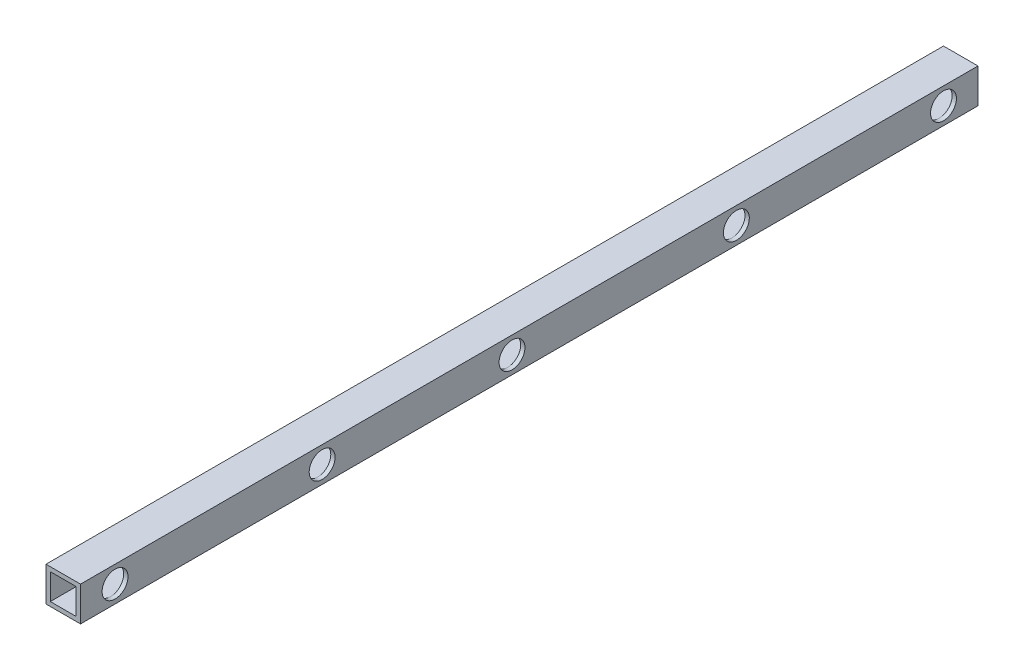
from build123d import *

# Parameters (mm, degrees)
SKETCH1_W           = 25.4
SKETCH1_H           = 25.4
SKETCH1_W_2         = 19.05
SKETCH1_H_2         = 19.05
EXTRUDE_THIN1_DEPTH = 660.4
SKETCH2_R           = 9.525
CUT_EXTRUDE1_DEPTH  = 662.376201568


with BuildPart() as part:
    # Sketch1 → Extrude-Thin1 (new body)
    with BuildSketch(Plane.XY):
        with Locations((-12.7, 12.7)):
            Rectangle(SKETCH1_W, SKETCH1_H)
        with Locations((-12.7, 12.7)):
            Rectangle(SKETCH1_W_2, SKETCH1_H_2, mode=Mode.SUBTRACT)
    extrude(amount=EXTRUDE_THIN1_DEPTH)

    # Sketch2 → Cut-Extrude1 (cut, through all)
    with BuildSketch(Plane.ZY.offset(25.4)):
        with Locations((25.4, 12.7)):
            Circle(SKETCH2_R)
        with Locations((177.8, 12.7)):
            Circle(SKETCH2_R)
        with Locations((482.6, 12.7)):
            Circle(SKETCH2_R)
        with Locations((635, 12.7)):
            Circle(SKETCH2_R)
        with Locations((342.9, 12.7)):
            Circle(SKETCH2_R)
    extrude(amount=-CUT_EXTRUDE1_DEPTH, mode=Mode.SUBTRACT)


solid = part.part
